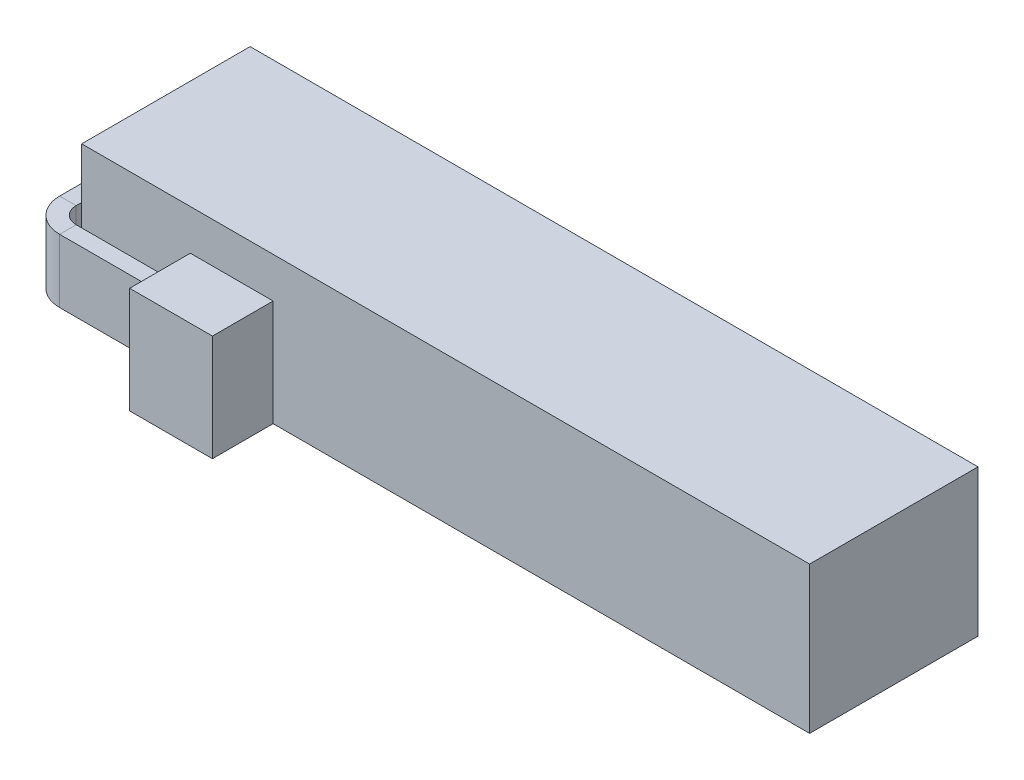
from build123d import *

# Parameters (mm, degrees)
SKETCH1_W           = 15.5
SKETCH1_H           = 13.5
BOSS_EXTRUDE1_DEPTH = 67
SKETCH2_W           = 7.62
SKETCH2_H           = 9.779
BOSS_EXTRUDE2_DEPTH = 5.588
SKETCH4_W           = 1.524
SKETCH4_H           = 5.842


with BuildPart() as part:
    # Sketch1 → Boss-Extrude1 (new body)
    with BuildSketch(Plane(origin=(0, 0, 0), x_dir=(0, 0, -1), z_dir=(1, 0, 0))):
        Rectangle(SKETCH1_W, SKETCH1_H)
    extrude(amount=BOSS_EXTRUDE1_DEPTH)

    # Sketch2 → Boss-Extrude2 (add)
    with BuildSketch(Plane.XY.offset(7.75)):
        with Locations((13.81, -1.8605)):
            Rectangle(SKETCH2_W, SKETCH2_H)
    extrude(amount=BOSS_EXTRUDE2_DEPTH)

    # Sweep1: sweep along a path in Sketch3
    with BuildLine(Plane(origin=(0, 0, 0), x_dir=(1, 0, 0), z_dir=(0, 1, 0))) as sweep1_path:
        Line((-0.762, 7.75), (-0.762, -7.242))
        ThreePointArc((-0.762, -7.242), (-0.390025612, -8.140025612), (0.508, -8.512))
        Line((0.508, -8.512), (10, -8.512))
    # Sketch4 → Sweep1 (sweep)
    with BuildSketch(Plane.ZY.offset(-10)):
        with Locations((9.528, -1.8605)):
            Rectangle(SKETCH4_W, SKETCH4_H)
    sweep(path=sweep1_path.line)


solid = part.part
